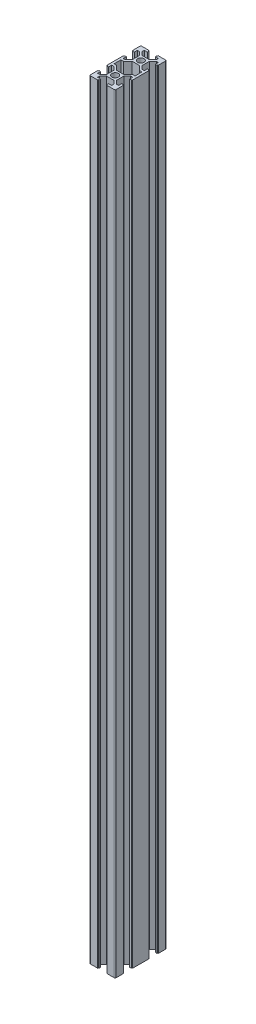
from build123d import *

# Parameters (mm, degrees)
BOSS_EXTRUDE2_DEPTH = 600


with BuildPart() as part:
    # Sketch1 → Boss-Extrude2 (new body)
    with BuildSketch(Plane(origin=(0, 0, 0), x_dir=(1, 0, 0), z_dir=(0, 1, 0))):
        with BuildLine():
            Line((23.9, 20), (23.9, 17.160660172))
            Line((23.9, 17.160660172), (26.560660172, 14.5))
            Line((26.560660172, 14.5), (28.2, 14.5))
            Line((28.2, 14.5), (28.2, 16.9))
            Line((28.2, 16.9), (29.5, 16.9))
            Line((29.5, 16.9), (29.5, 16.4))
            Line((29.5, 16.4), (30, 16.4))
            Line((30, 16.4), (30, 10.75))
            Line((30, 10.75), (30, 9.25))
            Line((30, 9.25), (30, 3.6))
            Line((30, 3.6), (29.5, 3.6))
            Line((29.5, 3.6), (29.5, 3.1))
            Line((29.5, 3.1), (28.2, 3.1))
            Line((28.2, 3.1), (28.2, 5.5))
            Line((28.2, 5.5), (26.560660172, 5.5))
            Line((26.560660172, 5.5), (23.9, 2.839339828))
            Line((23.9, 2.839339828), (23.9, 0))
            Line((23.9, 0), (23.9, -2.839339828))
            Line((23.9, -2.839339828), (26.560660172, -5.5))
            Line((26.560660172, -5.5), (28.2, -5.5))
            Line((28.2, -5.5), (28.2, -3.1))
            Line((28.2, -3.1), (29.5, -3.1))
            Line((29.5, -3.1), (29.5, -3.6))
            Line((29.5, -3.6), (30, -3.6))
            Line((30, -3.6), (30, -9.25))
            ThreePointArc((30, -9.25), (29.780330086, -9.780330086), (29.25, -10))
            Line((29.25, -10), (25.5, -10))
            Line((25.5, -10), (23.6, -10))
            Line((23.6, -10), (23.6, -9.5))
            Line((23.6, -9.5), (23.1, -9.5))
            Line((23.1, -9.5), (23.1, -8.2))
            Line((23.1, -8.2), (25.5, -8.2))
            Line((25.5, -8.2), (25.5, -6.560660172))
            Line((25.5, -6.560660172), (22.839339828, -3.9))
            Line((22.839339828, -3.9), (17.160660172, -3.9))
            Line((17.160660172, -3.9), (14.5, -6.560660172))
            Line((14.5, -6.560660172), (14.5, -8.2))
            Line((14.5, -8.2), (16.9, -8.2))
            Line((16.9, -8.2), (16.9, -9.5))
            Line((16.9, -9.5), (16.4, -9.5))
            Line((16.4, -9.5), (16.4, -10))
            Line((16.4, -10), (14.5, -10))
            Line((14.5, -10), (10.75, -10))
            ThreePointArc((10.75, -10), (10.219669914, -9.780330086), (10, -9.25))
            Line((10, -9.25), (10, -3.6))
            Line((10, -3.6), (10.5, -3.6))
            Line((10.5, -3.6), (10.5, -3.1))
            Line((10.5, -3.1), (11.8, -3.1))
            Line((11.8, -3.1), (11.8, -5.5))
            Line((11.8, -5.5), (13.439339828, -5.5))
            Line((13.439339828, -5.5), (16.1, -2.839339828))
            Line((16.1, -2.839339828), (16.1, 0))
            Line((16.1, 0), (16.1, 2.839339828))
            Line((16.1, 2.839339828), (13.439339828, 5.5))
            Line((13.439339828, 5.5), (11.8, 5.5))
            Line((11.8, 5.5), (11.8, 3.1))
            Line((11.8, 3.1), (10.5, 3.1))
            Line((10.5, 3.1), (10.5, 3.6))
            Line((10.5, 3.6), (10, 3.6))
            Line((10, 3.6), (10, 9.25))
            Line((10, 9.25), (10, 10.75))
            Line((10, 10.75), (10, 16.4))
            Line((10, 16.4), (10.5, 16.4))
            Line((10.5, 16.4), (10.5, 16.9))
            Line((10.5, 16.9), (11.8, 16.9))
            Line((11.8, 16.9), (11.8, 14.5))
            Line((11.8, 14.5), (13.439339828, 14.5))
            Line((13.439339828, 14.5), (16.1, 17.160660172))
            Line((16.1, 17.160660172), (16.1, 20))
            Line((16.1, 20), (16.1, 22.839339828))
            Line((16.1, 22.839339828), (13.439339828, 25.5))
            Line((13.439339828, 25.5), (11.8, 25.5))
            Line((11.8, 25.5), (11.8, 23.1))
            Line((11.8, 23.1), (10.5, 23.1))
            Line((10.5, 23.1), (10.5, 23.6))
            Line((10.5, 23.6), (10, 23.6))
            Line((10, 23.6), (10, 29.25))
            ThreePointArc((10, 29.25), (10.219669914, 29.780330086), (10.75, 30))
            Line((10.75, 30), (14.5, 30))
            Line((14.5, 30), (16.4, 30))
            Line((16.4, 30), (16.4, 29.5))
            Line((16.4, 29.5), (16.9, 29.5))
            Line((16.9, 29.5), (16.9, 28.2))
            Line((16.9, 28.2), (14.5, 28.2))
            Line((14.5, 28.2), (14.5, 26.560660172))
            Line((14.5, 26.560660172), (17.160660172, 23.9))
            Line((17.160660172, 23.9), (22.839339828, 23.9))
            Line((22.839339828, 23.9), (25.5, 26.560660172))
            Line((25.5, 26.560660172), (25.5, 28.2))
            Line((25.5, 28.2), (23.1, 28.2))
            Line((23.1, 28.2), (23.1, 29.5))
            Line((23.1, 29.5), (23.6, 29.5))
            Line((23.6, 29.5), (23.6, 30))
            Line((23.6, 30), (25.5, 30))
            Line((25.5, 30), (29.25, 30))
            ThreePointArc((29.25, 30), (29.780330086, 29.780330086), (30, 29.25))
            Line((30, 29.25), (30, 23.6))
            Line((30, 23.6), (29.5, 23.6))
            Line((29.5, 23.6), (29.5, 23.1))
            Line((29.5, 23.1), (28.2, 23.1))
            Line((28.2, 23.1), (28.2, 25.5))
            Line((28.2, 25.5), (26.560660172, 25.5))
            Line((26.560660172, 25.5), (23.9, 22.839339828))
            Line((23.9, 22.839339828), (23.9, 20))
        make_face()
        Polygon((17.160660172, 16.1), (13.760660172, 12.7), (11.8, 12.7), (11.8, 7.3), (13.760660172, 7.3), (17.160660172, 3.9), (22.839339828, 3.9), (26.239339828, 7.3), (28.2, 7.3), (28.2, 12.7), (26.239339828, 12.7), (22.839339828, 16.1), align=None, mode=Mode.SUBTRACT)
        with BuildLine():
            ThreePointArc((22.5, 20), (20, 17.5), (17.5, 20))
            ThreePointArc((17.5, 20), (20, 22.5), (22.5, 20))
        make_face(mode=Mode.SUBTRACT)
        with BuildLine():
            ThreePointArc((22.5, 0), (20, -2.5), (17.5, 0))
            ThreePointArc((17.5, 0), (20, 2.5), (22.5, 0))
        make_face(mode=Mode.SUBTRACT)
    extrude(amount=BOSS_EXTRUDE2_DEPTH)


solid = part.part
